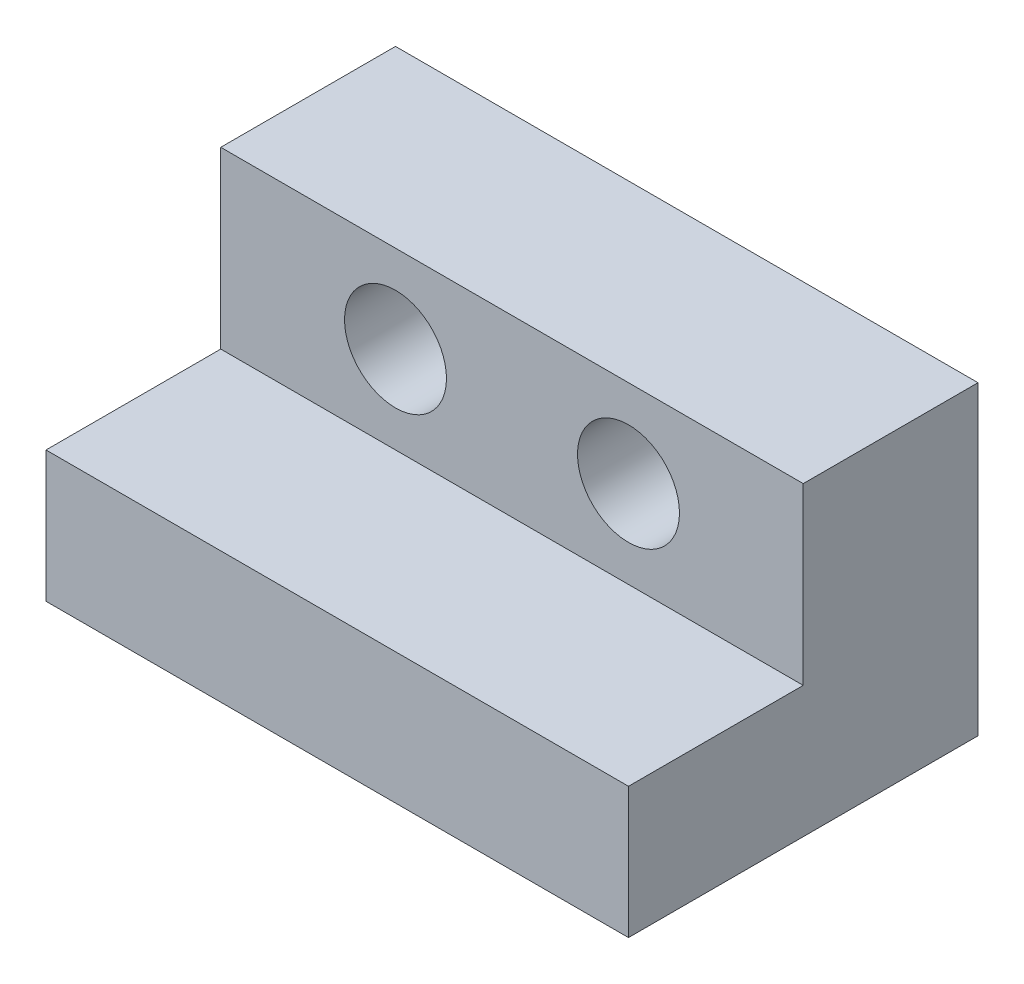
from build123d import *

# Parameters (mm, degrees)
SKETCH1_W           = 20
SKETCH1_H           = 10.5
SKETCH1_R           = 1.75
BOSS_EXTRUDE1_DEPTH = 12
CUT_EXTRUDE1_START  = -6
SKETCH2_W           = 20
SKETCH2_H           = 6
SKETCH2_R           = 1.75
CUT_EXTRUDE1_DEPTH  = 6
SKETCH3_R           = 4.25
CUT_EXTRUDE3_DEPTH  = 3


with BuildPart() as part:
    # Sketch1 → Boss-Extrude1 (new body)
    with BuildSketch(Plane.XY):
        with Locations((0, 10.25)):
            Rectangle(SKETCH1_W, SKETCH1_H)
        with Locations((4, 12.5)):
            Circle(SKETCH1_R, mode=Mode.SUBTRACT)
        with Locations(Location((-4, 12.5, 0), (0, 0, 180))):
            Circle(SKETCH1_R, mode=Mode.SUBTRACT)
    extrude(amount=BOSS_EXTRUDE1_DEPTH)

    # Sketch2 → Cut-Extrude1 (cut)
    with BuildSketch(Plane.XY.offset(12).offset(CUT_EXTRUDE1_START)):
        with Locations((0, 12.5)):
            Rectangle(SKETCH2_W, SKETCH2_H)
        with Locations(Location((-4, 12.5, 0), (0, 0, 180))):
            Circle(SKETCH2_R, mode=Mode.SUBTRACT)
        with Locations((4, 12.5)):
            Circle(SKETCH2_R, mode=Mode.SUBTRACT)
    extrude(amount=CUT_EXTRUDE1_DEPTH, mode=Mode.SUBTRACT)

    # Sketch3 → Cut-Extrude3 (cut)
    with BuildSketch(Plane.XZ.offset(-5)):
        with Locations(Location((0, 5, 0), (0, 0, 270))):
            Circle(SKETCH3_R)
    extrude(amount=-CUT_EXTRUDE3_DEPTH, mode=Mode.SUBTRACT)


solid = part.part
